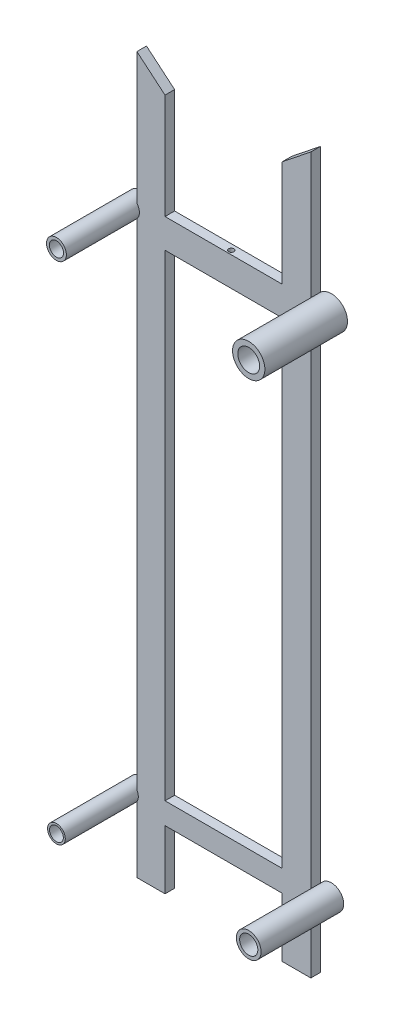
from build123d import *

# Parameters (mm, degrees)
BOSS_EXTRUDE1_START   = 600
SKETCH1_R             = 57.281017464
SKETCH1_R_2           = 38.771715285
BOSS_EXTRUDE1_DEPTH   = 293
SKETCH1_R_3           = 35.256926628
SKETCH1_R_4           = 25.147423748
BOSS_EXTRUDE1_2_DEPTH = 293
SKETCH1_R_5           = 31.428515318
SKETCH1_R_6           = 24.521075722
BOSS_EXTRUDE1_3_DEPTH = 293
SKETCH1_R_7           = 43.796557911
SKETCH1_R_8           = 32.254492843
BOSS_EXTRUDE1_4_DEPTH = 293
SKETCH2_W             = 616.707969139
SKETCH2_H             = 76.195303947
SKETCH2_H_2           = 103.48726304
BOSS_EXTRUDE2_DEPTH   = 34
SKETCH6_R             = 9.313662058
CUT_EXTRUDE3_DEPTH    = 126


with BuildPart() as part:
    # Sketch1 → Boss-Extrude1 (new body)
    with BuildSketch(Plane.XY.offset(427.014108562).offset(BOSS_EXTRUDE1_START)):
        with Locations((1173.639225527, -317.201613393)):
            Circle(SKETCH1_R)
        with Locations((1173.639225527, -317.201613393)):
            Circle(SKETCH1_R_2, mode=Mode.SUBTRACT)
    extrude(amount=BOSS_EXTRUDE1_DEPTH)



with BuildPart() as body_2:
    # Sketch1 → Boss-Extrude1 2 (new body)
    with BuildSketch(Plane.XY.offset(427.014108562).offset(BOSS_EXTRUDE1_START)):
        with Locations((491.765116758, -317.201613393)):
            Circle(SKETCH1_R_3)
        with Locations((491.765116758, -317.201613393)):
            Circle(SKETCH1_R_4, mode=Mode.SUBTRACT)
    extrude(amount=BOSS_EXTRUDE1_2_DEPTH)


with BuildPart() as body_3:
    # Sketch1 → Boss-Extrude1 3 (new body)
    with BuildSketch(Plane.XY.offset(427.014108562).offset(BOSS_EXTRUDE1_START)):
        with Locations((491.765116758, -2112.860849235)):
            Circle(SKETCH1_R_5)
        with Locations((491.765116758, -2112.860849235)):
            Circle(SKETCH1_R_6, mode=Mode.SUBTRACT)
    extrude(amount=BOSS_EXTRUDE1_3_DEPTH)


with BuildPart() as body_4:
    # Sketch1 → Boss-Extrude1 4 (new body)
    with BuildSketch(Plane.XY.offset(427.014108562).offset(BOSS_EXTRUDE1_START)):
        with Locations((1173.639225527, -2112.860849235)):
            Circle(SKETCH1_R_7)
        with Locations((1173.639225527, -2112.860849235)):
            Circle(SKETCH1_R_8, mode=Mode.SUBTRACT)
    extrude(amount=BOSS_EXTRUDE1_4_DEPTH)


with BuildPart() as part_1:
    add(part.part)

    add(body_2.part)  # Boss-Extrude2 merges body 2

    add(body_3.part)  # Boss-Extrude2 merges body 3

    add(body_4.part)  # Boss-Extrude2 merges body 4
    # Sketch2 → Boss-Extrude2 (add)
    with BuildSketch(Plane(origin=(0, 0, 1027.014108562), x_dir=(-1, 0, 0), z_dir=(0, 0, -1))):
        Polygon((-1134.867510242, 91.617150216), (-1134.867510242, 172.765208514), (-1033.166693927, 91.617150216), (-1033.166693927, -2363.997444221), (-1134.867510242, -2363.997444221), align=None)
        Polygon((-518.159541103, -2363.997444221), (-617.883714932, -2363.997444221), (-617.883714932, 88.905828795), (-518.159541103, 172.765208514), (-518.159541103, 88.905828795), align=None)
        with Locations((-826.513525673, -2116.408610896)):
            Rectangle(SKETCH2_W, SKETCH2_H)
        with Locations((-826.513525673, -335.838828239)):
            Rectangle(SKETCH2_W, SKETCH2_H_2)
    extrude(amount=-BOSS_EXTRUDE2_DEPTH)

    # Sketch6 → Cut-Extrude3 (cut)
    with BuildSketch(Plane(origin=(0, -284.095196719, 0), x_dir=(1, 0, 0), z_dir=(0, 1, 0))):
        with Locations(Location((838.898443774, -1047.155157013, 0), (0, 0, 270))):
            Circle(SKETCH6_R)
    extrude(amount=-CUT_EXTRUDE3_DEPTH, mode=Mode.SUBTRACT)


solid = part_1.part
